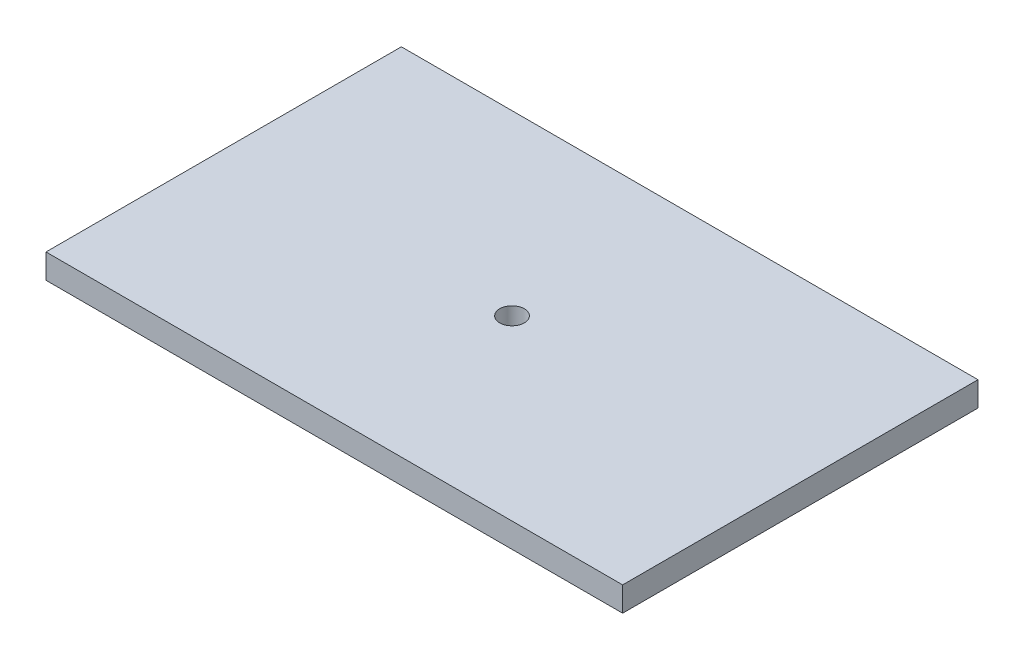
from build123d import *

# Parameters (mm, degrees)
SKETCH1_W           = 234.80212105
SKETCH1_H           = 144.70363274
BOSS_EXTRUDE1_DEPTH = 10
SKETCH2_R           = 5
CUT_EXTRUDE1_DEPTH  = 10


with BuildPart() as part:
    # Sketch1 → Boss-Extrude1 (new body)
    with BuildSketch(Plane(origin=(0, 0, 0), x_dir=(1, 0, 0), z_dir=(0, 1, 0))):
        Rectangle(SKETCH1_W, SKETCH1_H)
    extrude(amount=BOSS_EXTRUDE1_DEPTH)

    # Sketch2 → Cut-Extrude1 (cut)
    with BuildSketch(Plane(origin=(0, 10, 0), x_dir=(1, 0, 0), z_dir=(0, 1, 0))):
        with Locations(Location((0, 0, 0), (0, 0, 270))):
            Circle(SKETCH2_R)
    extrude(amount=-CUT_EXTRUDE1_DEPTH, mode=Mode.SUBTRACT)


solid = part.part
